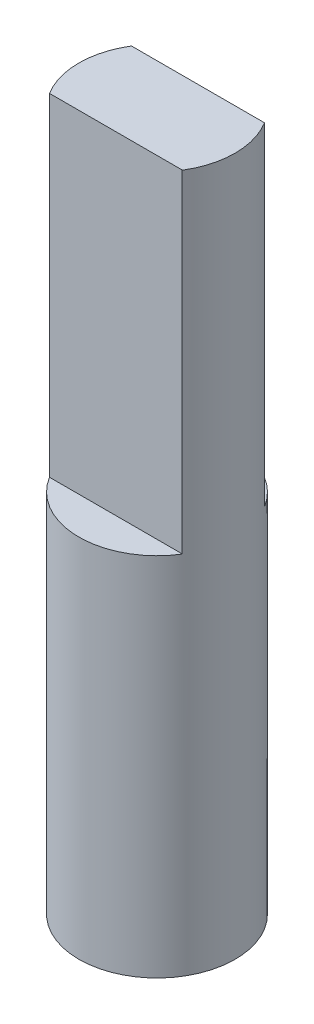
from build123d import *

# Parameters (mm, degrees)
SKETCH_1_R          = 2.35
EXTRUDE_1_DEPTH     = 21
SKETCH_2_W          = 4
SKETCH_2_H          = 1.233219009
SKETCH_2_H_2        = 1.204428022
CUT_EXTRUDE_6_DEPTH = 10


with BuildPart() as part:
    # 스케치1 → 보스-돌출1 (new body)
    with BuildSketch(Plane(origin=(0, 0, 0), x_dir=(1, 0, 0), z_dir=(0, 1, 0))):
        with Locations(Location((0, 0, 0), (0, 0, 90))):
            Circle(SKETCH_1_R)
    extrude(amount=EXTRUDE_1_DEPTH)

    # 스케치2 → 컷-돌출6 (cut)
    with BuildSketch(Plane(origin=(0, 21, 0), x_dir=(1, 0, 0), z_dir=(0, 1, 0))):
        with Locations((-0.00362645, 1.850505773)):
            Rectangle(SKETCH_2_W, SKETCH_2_H)
        with Locations((-0.00362645, -1.836110279)):
            Rectangle(SKETCH_2_W, SKETCH_2_H_2)
    extrude(amount=-CUT_EXTRUDE_6_DEPTH, mode=Mode.SUBTRACT)


solid = part.part
